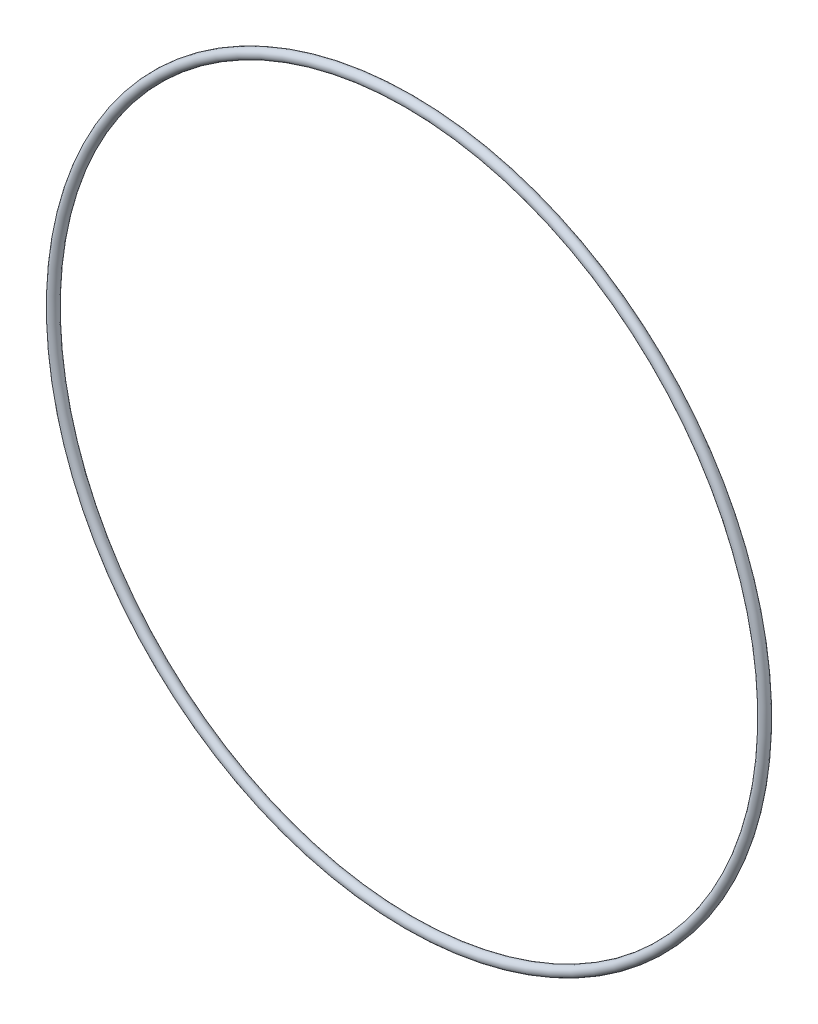
from build123d import *

# Parameters (mm, degrees)
SKETCH2_R = 0.889


with BuildPart() as part:
    # Sketch2 → Revolve1 (revolve)
    with BuildSketch(Plane(origin=(0, 0, 0), x_dir=(0, 0, -1), z_dir=(1, 0, 0)), mode=Mode.PRIVATE) as revolve1_sk:
        with Locations((0, 64.2493)):
            Circle(SKETCH2_R)
    revolve(revolve1_sk.sketch.rotate(Axis((0, 0, 63.3603), (0, 0, -1)), 180), axis=Axis((0, 0, 63.3603), (0, 0, -1)))


solid = part.part
